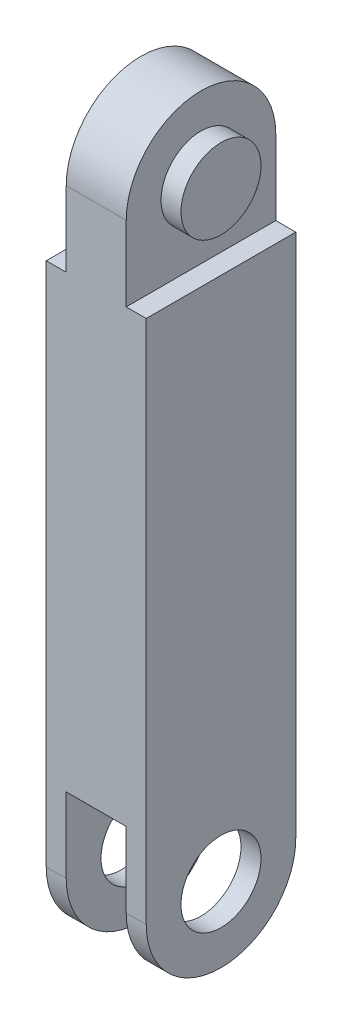
from build123d import *

# Parameters (mm, degrees)
BOSS_EXTRUDE1_DEPTH = 100
CUT_EXTRUDE2_DEPTH  = 20
CUT_EXTRUDE3_START  = -20
CUT_EXTRUDE3_DEPTH  = 20
SKETCH10_R          = 40
BOSS_EXTRUDE6_DEPTH = 20
BOSS_EXTRUDE7_START = 20
SKETCH11_R          = 40
BOSS_EXTRUDE7_DEPTH = 20
SKETCH19_R          = 40
CUT_EXTRUDE7_DEPTH  = 285
SKETCH16_W          = 60
SKETCH16_H          = 150
CUT_EXTRUDE8_DEPTH  = 285


with BuildPart() as part:
    # Sketch1 → Boss-Extrude1 (new body)
    with BuildSketch(Plane(origin=(0, 0, 0), x_dir=(0, 0, -1), z_dir=(1, 0, 0))):
        with BuildLine():
            Line((-74.767803634, 0), (-74.767803634, 600))
            ThreePointArc((-74.767803634, 600), (0, 674.767803634), (74.767803634, 600))
            Line((74.767803634, 600), (74.767803634, 0))
            ThreePointArc((74.767803634, 0), (0, -74.767803634), (-74.767803634, 0))
        make_face()
    extrude(amount=BOSS_EXTRUDE1_DEPTH)

    # Sketch8 → Cut-Extrude2 (cut)
    with BuildSketch(Plane.ZY):
        with BuildLine():
            Line((-74.767803634, 600), (-74.767803634, 525))
            Line((-74.767803634, 525), (74.767803634, 525))
            Line((74.767803634, 525), (74.767803634, 600))
            ThreePointArc((74.767803634, 600), (0, 674.767803634), (-74.767803634, 600))
        make_face()
    extrude(amount=-CUT_EXTRUDE2_DEPTH, mode=Mode.SUBTRACT)

    # Sketch7 → Cut-Extrude3 (cut)
    with BuildSketch(Plane(origin=(100, 0, 0), x_dir=(0, 0, -1), z_dir=(1, 0, 0)).offset(CUT_EXTRUDE3_START)):
        with BuildLine():
            Line((-74.767803634, 600), (-74.767803634, 525))
            Line((-74.767803634, 525), (74.767803634, 525))
            Line((74.767803634, 525), (74.767803634, 600))
            ThreePointArc((74.767803634, 600), (0, 674.767803634), (-74.767803634, 600))
        make_face()
    extrude(amount=CUT_EXTRUDE3_DEPTH, mode=Mode.SUBTRACT)

    # Sketch10 → Boss-Extrude6 (add)
    with BuildSketch(Plane(origin=(80, 0, 0), x_dir=(0, 0, -1), z_dir=(1, 0, 0))):
        with Locations(Location((0, 600, 0), (0, 0, 180))):
            Circle(SKETCH10_R)
    extrude(amount=BOSS_EXTRUDE6_DEPTH)

    # Sketch11 → Boss-Extrude7 (add)
    with BuildSketch(Plane.ZY.offset(-20).offset(BOSS_EXTRUDE7_START)):
        with Locations((0, 600)):
            Circle(SKETCH11_R)
    extrude(amount=-BOSS_EXTRUDE7_DEPTH)

    # Sketch19 → Cut-Extrude7 (cut)
    with BuildSketch(Plane.ZY):
        Circle(SKETCH19_R)
    extrude(amount=-CUT_EXTRUDE7_DEPTH, mode=Mode.SUBTRACT)

    # Sketch16 → Cut-Extrude8 (cut)
    with BuildSketch(Plane.XY.offset(74.767803634)):
        with Locations((50, 0)):
            Rectangle(SKETCH16_W, SKETCH16_H)
    extrude(amount=-CUT_EXTRUDE8_DEPTH, mode=Mode.SUBTRACT)


solid = part.part
